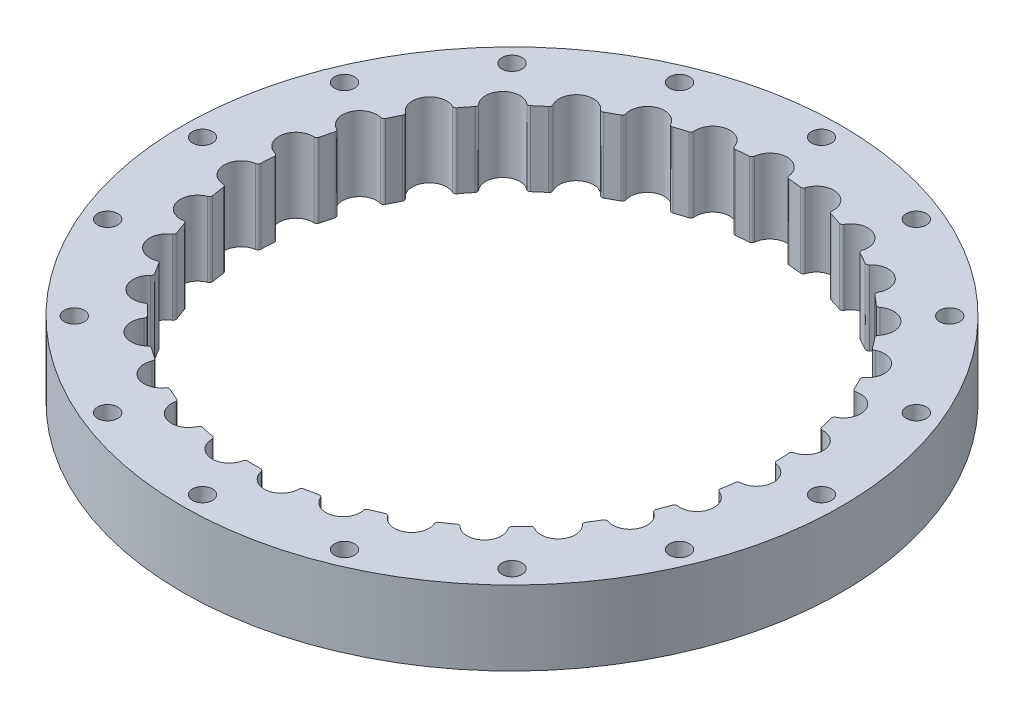
from build123d import *

# Parameters (mm, degrees)
SKETCH1_R                = 57.5
SKETCH1_R_2              = 45
BOSS_EXTRUDE1_DEPTH      = 13
BOSS_EXTRUDE2_START      = 1
SKETCH2_R                = 57.5
SKETCH2_R_2              = 45
BOSS_EXTRUDE2_DEPTH      = 1
BOSS_EXTRUDE3_START      = 2
SKETCH3_R                = 57.5
SKETCH3_R_2              = 42.5
BOSS_EXTRUDE3_DEPTH      = 2
SKETCH5_R                = 3
CUT_EXTRUDE2_DEPTH       = 13
FILLET4_R                = 0.5
SKETCH10_R               = 57.5
SKETCH10_R_2             = 45
BOSS_EXTRUDE4_DEPTH      = 1
SKETCH11_R               = 57.5
SKETCH11_R_2             = 42.5
BOSS_EXTRUDE5_DEPTH      = 2
SKETCH7_R                = 1.75
CUT_EXTRUDE3_DEPTH       = 23
CIRPATTERN3_COUNT        = 31
FILLET4_OF_CIRPATTERN3_R = 0.5
SKETCH4_R                = 1.75
CUT_EXTRUDE1_DEPTH       = 51
SKETCH15_R               = 106.079195098
CUT_EXTRUDE5_DEPTH       = 10
SKETCH16_R               = 89.806832091
CUT_EXTRUDE6_DEPTH       = 10


with BuildPart() as part:
    # Sketch1 → Boss-Extrude1 (new body)
    with BuildSketch(Plane(origin=(0, 0, 0), x_dir=(1, 0, 0), z_dir=(0, 1, 0))):
        with Locations(Location((0, 0, 0), (0, 0, 90))):
            Circle(SKETCH1_R)
        with Locations(Location((0, 0, 0), (0, 0, 90))):
            Circle(SKETCH1_R_2, mode=Mode.SUBTRACT)
    extrude(amount=BOSS_EXTRUDE1_DEPTH)

    # Sketch2 → Boss-Extrude2 (add)
    with BuildSketch(Plane.XZ.offset(BOSS_EXTRUDE2_START)):
        with Locations(Location((0, 0, 0), (0, 0, 270))):
            Circle(SKETCH2_R)
        with Locations(Location((0, 0, 0), (0, 0, 270))):
            Circle(SKETCH2_R_2, mode=Mode.SUBTRACT)
    extrude(amount=-BOSS_EXTRUDE2_DEPTH)

    # Sketch3 → Boss-Extrude3 (add)
    with BuildSketch(Plane.XZ.offset(1).offset(BOSS_EXTRUDE3_START)):
        with Locations(Location((0, 0, 0), (0, 0, 270))):
            Circle(SKETCH3_R)
        with Locations(Location((0, 0, 0), (0, 0, 270))):
            Circle(SKETCH3_R_2, mode=Mode.SUBTRACT)
    extrude(amount=-BOSS_EXTRUDE3_DEPTH)

    # Sketch5 → Cut-Extrude2 (cut)
    with BuildSketch(Plane(origin=(0, 13, 0), x_dir=(1, 0, 0), z_dir=(0, 1, 0))):
        with Locations((0, 45)):
            Circle(SKETCH5_R)
    cut_extrude2 = extrude(amount=-CUT_EXTRUDE2_DEPTH, mode=Mode.SUBTRACT)

    # Fillet4
    fillet4_edges = [part.edges().sort_by_distance(p)[0] for p in [
        (2.99833287, 6.5, -44.9),
        (-2.99833287, 6.5, -44.9),
    ]]
    fillet(fillet4_edges, radius=FILLET4_R)

    # Sketch10 → Boss-Extrude4 (add)
    with BuildSketch(Plane(origin=(0, 13, 0), x_dir=(1, 0, 0), z_dir=(0, 1, 0))):
        with Locations(Location((0, 0, 0), (0, 0, 90))):
            Circle(SKETCH10_R)
        with Locations(Location((0, 0, 0), (0, 0, 90))):
            Circle(SKETCH10_R_2, mode=Mode.SUBTRACT)
    extrude(amount=BOSS_EXTRUDE4_DEPTH)

    # Sketch11 → Boss-Extrude5 (add)
    with BuildSketch(Plane(origin=(0, 14, 0), x_dir=(1, 0, 0), z_dir=(0, 1, 0))):
        with Locations(Location((0, 0, 0), (0, 0, 90))):
            Circle(SKETCH11_R)
        with Locations(Location((0, 0, 0), (0, 0, 90))):
            Circle(SKETCH11_R_2, mode=Mode.SUBTRACT)
    extrude(amount=BOSS_EXTRUDE5_DEPTH)

    # Sketch7 → Cut-Extrude3 (cut)
    with BuildSketch(Plane(origin=(0, 16, 0), x_dir=(1, 0, 0), z_dir=(0, 1, 0))):
        with Locations(Location((0, 45, 0), (0, 0, 270))):
            Circle(SKETCH7_R)
    cut_extrude3 = extrude(amount=-CUT_EXTRUDE3_DEPTH, mode=Mode.SUBTRACT)

    # CirPattern3: Cut-Extrude2, Cut-Extrude3 ×31 about axis
    cirpattern3_axis = Axis((0, 0, 0), (0, 1, 0))
    add([cut_extrude2.rotate(cirpattern3_axis, i * 360 / CIRPATTERN3_COUNT) for i in range(1, CIRPATTERN3_COUNT)], mode=Mode.SUBTRACT)
    add([cut_extrude3.rotate(cirpattern3_axis, i * 360 / CIRPATTERN3_COUNT) for i in range(1, CIRPATTERN3_COUNT)], mode=Mode.SUBTRACT)

    # Fillet4 of CirPattern3
    fillet4_of_cirpattern3_edges = [part.edges().sort_by_distance(p)[0] for p in [
        (-6.101346732, 6.5, -44.584454332),
        (-11.975260372, 6.5, -43.377334393),
        (-14.951236482, 6.5, -42.443615865),
        (-20.461919307, 6.5, -40.078795619),
        (-23.189020853, 6.5, -38.565130777),
        (-28.110864862, 6.5, -35.139426243),
        (-30.477443987, 6.5, -33.107784704),
        (-34.608948306, 6.5, -28.761444629),
        (-36.518116982, 6.5, -26.295002036),
        (-39.690137341, 6.5, -21.205966091),
        (-41.063733978, 6.5, -18.405698895),
        (-43.146407489, 6.5, -12.782312811),
        (-43.92819688, 6.5, -9.762864278),
        (-44.836258645, 6.5, -3.835350142),
        (-44.99423424, 6.5, -0.720336851),
        (-44.690508104, 6.5, 5.268632212),
        (-44.218202364, 6.5, 8.351681252),
        (-42.715122911, 6.5, 14.156916145),
        (-41.631872087, 6.5, 17.081780543),
        (-38.990975566, 6.5, 22.465614267),
        (-37.341128076, 6.5, 25.112549731),
        (-33.670533101, 6.5, 29.854567501),
        (-31.521633894, 6.5, 32.115208183),
        (-26.971615054, 6.5, 36.021271235),
        (-24.411640317, 6.5, 37.803066239),
        (-19.168475919, 6.5, 40.713259891),
        (-16.302231317, 6.5, 41.943262321),
        (-10.580577126, 6.5, 43.738442904),
        (-7.525407051, 6.5, 44.366296315),
        (-1.559508263, 6.5, 44.972968926),
        (1.559508263, 6.5, 44.972968926),
        (7.525407051, 6.5, 44.366296315),
        (10.580577126, 6.5, 43.738442904),
        (16.302231317, 6.5, 41.943262321),
        (19.168475919, 6.5, 40.713259891),
        (24.411640317, 6.5, 37.803066239),
        (26.971615054, 6.5, 36.021271235),
        (31.521633894, 6.5, 32.115208183),
        (33.670533101, 6.5, 29.854567501),
        (37.341128076, 6.5, 25.112549731),
        (38.990975566, 6.5, 22.465614267),
        (41.631872087, 6.5, 17.081780543),
        (42.715122911, 6.5, 14.156916145),
        (44.218202364, 6.5, 8.351681252),
        (44.690508104, 6.5, 5.268632212),
        (44.99423424, 6.5, -0.720336851),
        (44.836258645, 6.5, -3.835350142),
        (43.92819688, 6.5, -9.762864278),
        (43.146407489, 6.5, -12.782312811),
        (41.063733978, 6.5, -18.405698895),
        (39.690137341, 6.5, -21.205966091),
        (36.518116982, 6.5, -26.295002036),
        (34.608948306, 6.5, -28.761444629),
        (30.477443987, 6.5, -33.107784704),
        (28.110864862, 6.5, -35.139426243),
        (23.189020853, 6.5, -38.565130777),
        (20.461919307, 6.5, -40.078795619),
        (14.951236482, 6.5, -42.443615865),
        (11.975260372, 6.5, -43.377334393),
        (6.101346732, 6.5, -44.584454332),
    ]]
    fillet(fillet4_of_cirpattern3_edges, radius=FILLET4_OF_CIRPATTERN3_R)

    # Sketch4 → Cut-Extrude1 (cut)
    with BuildSketch(Plane(origin=(0, 16, 0), x_dir=(1, 0, 0), z_dir=(0, 1, 0))):
        with Locations(Location((0, 54, 0), (0, 0, 270))):
            Circle(SKETCH4_R)
        with Locations(Location((20.664905348, 49.889494756, 0), (0, 0, 270))):
            Circle(SKETCH4_R)
        with Locations(Location((38.183766184, 38.183766184, 0), (0, 0, 270))):
            Circle(SKETCH4_R)
        with Locations(Location((49.889494756, 20.664905348, 0), (0, 0, 270))):
            Circle(SKETCH4_R)
        with Locations(Location((54, 0, 0), (0, 0, 270))):
            Circle(SKETCH4_R)
        with Locations(Location((49.889494756, -20.664905348, 0), (0, 0, 270))):
            Circle(SKETCH4_R)
        with Locations(Location((38.183766184, -38.183766184, 0), (0, 0, 270))):
            Circle(SKETCH4_R)
        with Locations(Location((20.664905348, -49.889494756, 0), (0, 0, 270))):
            Circle(SKETCH4_R)
        with Locations(Location((0, -54, 0), (0, 0, 270))):
            Circle(SKETCH4_R)
        with Locations(Location((-20.664905348, -49.889494756, 0), (0, 0, 270))):
            Circle(SKETCH4_R)
        with Locations(Location((-38.183766184, -38.183766184, 0), (0, 0, 270))):
            Circle(SKETCH4_R)
        with Locations(Location((-49.889494756, -20.664905348, 0), (0, 0, 270))):
            Circle(SKETCH4_R)
        with Locations(Location((-54, 0, 0), (0, 0, 270))):
            Circle(SKETCH4_R)
        with Locations(Location((-49.889494756, 20.664905348, 0), (0, 0, 270))):
            Circle(SKETCH4_R)
        with Locations(Location((-38.183766184, 38.183766184, 0), (0, 0, 270))):
            Circle(SKETCH4_R)
        with Locations(Location((-20.664905348, 49.889494756, 0), (0, 0, 270))):
            Circle(SKETCH4_R)
    extrude(amount=-CUT_EXTRUDE1_DEPTH, mode=Mode.SUBTRACT)

    # Sketch15 → Cut-Extrude5 (cut)
    with BuildSketch(Plane(origin=(0, 0, 0), x_dir=(1, 0, 0), z_dir=(0, 1, 0))):
        Circle(SKETCH15_R)
    extrude(amount=-CUT_EXTRUDE5_DEPTH, mode=Mode.SUBTRACT)

    # Sketch16 → Cut-Extrude6 (cut)
    with BuildSketch(Plane.XZ.offset(-13)):
        Circle(SKETCH16_R)
    extrude(amount=-CUT_EXTRUDE6_DEPTH, mode=Mode.SUBTRACT)


solid = part.part
